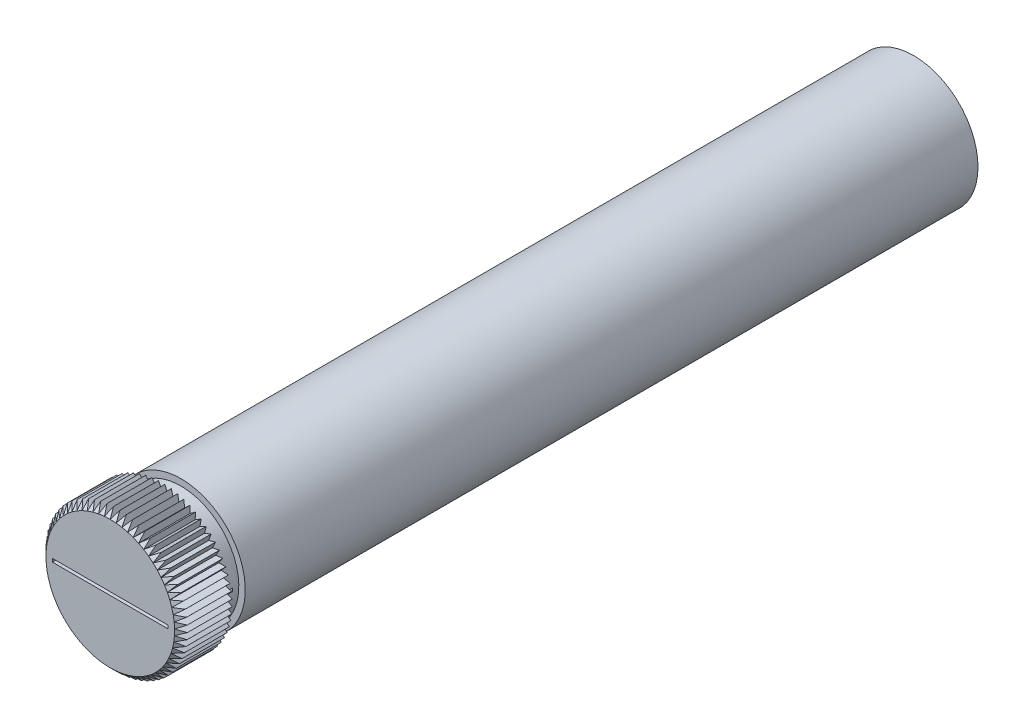
from build123d import *

# Parameters (mm, degrees)
SKETCH_1_R          = 10
EXTRUDE_1_DEPTH     = 125
SKETCH_2_R          = 11
EXTRUDE_2_DEPTH     = 8
CHAMFER_1_SIZE      = 1
CUT_EXTRUDE_1_DEPTH = 8
CUT_EXTRUDE_START   = 3
SKETCH_4_R          = 10
SKETCH_4_R_2        = 9
CUT_EXTRUDE_2_DEPTH = 3
SKETCH_5_W          = 18
SKETCH_5_H          = 0.5
CUT_EXTRUDE_3_DEPTH = 10


with BuildPart() as part:
    # 草图1 → 凸台-拉伸1 (new body)
    with BuildSketch(Plane.XY):
        Circle(SKETCH_1_R)
    extrude(amount=EXTRUDE_1_DEPTH)

    # 草图2 → 凸台-拉伸2 (add)
    with BuildSketch(Plane.XY.offset(125)):
        Circle(SKETCH_2_R)
    extrude(amount=-EXTRUDE_2_DEPTH)

    # 倒角1
    chamfer_1_edges = [part.edges().sort_by_distance(p)[0] for p in [
        (-11, 0, 125),
    ]]
    chamfer(chamfer_1_edges, length=CHAMFER_1_SIZE)

    # 草图3 → 切除-拉伸1 (cut)
    with BuildSketch(Plane.XY.offset(125)):
        Polygon((0, 11.3), (-0.5, 10.988630488), (0, 10), (0.5, 10.988630488), align=None)
        Polygon((1.497178022, 10.89763543), (0.909348623, 9.958568425), (0.501321179, 10.988570293), (1.027563944, 11.253182321), align=None)
        Polygon((2.481949955, 10.716339133), (1.811162097, 9.834617016), (1.498488253, 10.897455343), (2.04661317, 11.113117228), align=None)
        Polygon((3.446155669, 10.446243876), (2.697967712, 9.629172873), (2.483238381, 10.716040647), (3.048703514, 10.880965347), align=None)
        Polygon((4.381805452, 10.089587751), (3.562417116, 9.343938372), (3.447411614, 10.445829463), (4.025531341, 10.55865036), align=None)
        Polygon((5.281146215, 9.649326125), (4.39734721, 8.981277054), (4.383018509, 10.089060846), (4.969002347, 10.148843071), align=None)
        Polygon((6.136725737, 9.129107143), (5.1958395, 8.544194045), (5.282306332, 9.648691093), (5.871298635, 9.654939271), align=None)
        Polygon((6.941454417, 8.533241505), (5.951277428, 8.036311155), (6.137823301, 9.128369248), (6.724943494, 9.081031605), align=None)
        Polygon((7.688664019, 7.86666674), (6.657401197, 7.461836858), (6.942480333, 8.53240686), (7.522863353, 8.43187565), align=None)
        Polygon((8.37216293, 7.134906297), (7.308359643, 6.825531432), (7.689609787, 7.865742261), (8.258446396, 7.712850518), align=None)
        Polygon((8.986287463, 6.344023773), (7.898758719, 6.132667503), (8.373020712, 7.133899645), (8.925597352, 6.929914278), align=None)
        Polygon((9.525948787, 5.500572671), (8.423706193, 5.388986359), (8.987050151, 6.34294329), (9.518787998, 6.089554586), align=None)
        Polygon((9.9866751, 4.611542091), (8.878852184, 4.600650377), (9.526610062, 5.499427309), (10.033102968, 5.198734926), align=None)
        Polygon((10.364648677, 3.684298821), (9.26042521, 3.774191958), (9.987229481, 4.610341342), (10.464280487, 4.264836912), align=None)
        Polygon((10.656737512, 2.72652629), (9.565263436, 2.916459395), (10.365091572, 3.683052634), (10.808747683, 3.295599116), align=None)
        Polygon((10.860521263, 1.746160904), (9.790840877, 2.034560131), (10.65706525, 2.725244992), (11.063650191, 2.299052948), align=None)
        Polygon((10.974311314, 0.751326279), (9.935288327, 1.135801861), (10.860731128, 1.744855112), (11.226875809, 1.283456102), align=None)
        Polygon((10.997164766, -0.249734072), (9.997408848, 0.227631979), (10.974401568, 0.750006812), (11.297071999, 0.257224136), align=None)
        Polygon((10.928892247, -1.248725049), (9.976687692, -0.682424134), (10.997134661, -0.251056279), (11.273657092, -0.771139271), align=None)
        Polygon((10.770059485, -2.237368696), (9.873296559, -1.586825465), (10.928742032, -1.25003904), (11.156825112, -1.793112775), align=None)
        Polygon((10.521982619, -3.207472801), (9.688092182, -2.47807786), (10.769790405, -2.238663583), (10.947544165, -2.800227982), align=None)
        Polygon((10.18671729, -4.150998777), (9.422609221, -3.348796122), (10.521596902, -3.208737855), (10.64754842, -3.784139618), align=None)
        Polygon((9.767041614, -5.06012827), (9.079047553, -4.191765204), (10.186218135, -4.152223514), (10.259323735, -4.736694681), align=None)
        Polygon((9.266433155, -5.927327946), (8.660254038, -5), (9.766433155, -5.061302542), (9.786087063, -5.65), align=None)
        Polygon((8.689040113, -6.745411916), (8.16969893, -5.766803221), (9.265720435, -5.928442023), (9.231759791, -6.51648764), align=None)
        Polygon((8.039646948, -7.507601278), (7.611447124, -6.485820895), (8.688229037, -6.746456566), (8.60093525, -7.328977611), align=None)
        Polygon((7.323634736, -8.207580292), (6.99012447, -7.151095014), (8.038744237, -7.508567845), (7.898840651, -8.080737365), align=None)
        Polygon((6.54693658, -8.839548711), (6.310879443, -7.757112907), (7.322647871, -8.208460767), (7.131293771, -8.765537585), align=None)
        Polygon((5.715988446, -9.398269845), (5.579340482, -8.29885292), (6.545873738, -8.840335797), (6.304654745, -9.3777038), align=None)
        Polygon((4.837675832, -9.879113956), (4.801569348, -8.771826024), (5.714858434, -9.398957021), (5.425773363, -9.912163407), align=None)
        Polygon((3.919276712, -10.278096617), (3.984010898, -9.172113015), (4.836488013, -9.879695527), (4.501932315, -10.364487707), align=None)
        Polygon((2.96840123, -10.591911732), (3.13343968, -9.496396989), (3.918040929, -10.278567764), (3.540786838, -10.730928598), align=None)
        Polygon((1.992928642, -10.817958931), (2.256903793, -9.741990827), (2.967127724, -10.592268552), (2.550301286, -11.008449634), align=None)
        Polygon((1.000942019, -10.954365115), (1.361666491, -9.90685946), (1.991627965, -10.818198466), (1.538683135, -11.19475119), align=None)
        Polygon((0.000661275, -10.99999998), (0.455145991, -9.989636736), (0.999624949, -10.954485381), (0.51431497, -11.288289512), align=None)
        Polygon((-0.999624948, -10.954485381), (-0.455145991, -9.989636736), (-0.000661275, -10.99999998), (-0.51431497, -11.288289512), align=None)
        Polygon((-1.991627965, -10.818198466), (-1.361666491, -9.90685946), (-1.000942019, -10.954365115), (-1.538683135, -11.19475119), align=None)
        Polygon((-2.967127724, -10.592268552), (-2.256903793, -9.741990827), (-1.992928642, -10.817958931), (-2.550301286, -11.008449634), align=None)
        Polygon((-3.918040929, -10.278567764), (-3.13343968, -9.496396989), (-2.96840123, -10.591911732), (-3.540786838, -10.730928598), align=None)
        Polygon((-4.836488013, -9.879695527), (-3.984010898, -9.172113015), (-3.919276712, -10.278096617), (-4.501932315, -10.364487707), align=None)
        Polygon((-5.714858434, -9.398957021), (-4.801569348, -8.771826024), (-4.837675832, -9.879113956), (-5.425773363, -9.912163407), align=None)
        Polygon((-6.545873738, -8.840335797), (-5.579340482, -8.29885292), (-5.715988446, -9.398269845), (-6.304654744, -9.3777038), align=None)
        Polygon((-7.322647871, -8.208460767), (-6.310879443, -7.757112907), (-6.54693658, -8.839548711), (-7.131293771, -8.765537585), align=None)
        Polygon((-8.038744237, -7.508567845), (-6.99012447, -7.151095014), (-7.323634736, -8.207580292), (-7.898840651, -8.080737365), align=None)
        Polygon((-8.688229037, -6.746456566), (-7.611447124, -6.485820895), (-8.039646948, -7.507601278), (-8.60093525, -7.328977611), align=None)
        Polygon((-9.265720435, -5.928442023), (-8.16969893, -5.766803221), (-8.689040113, -6.745411916), (-9.231759791, -6.51648764), align=None)
        Polygon((-9.766433155, -5.061302542), (-8.660254038, -5), (-9.266433155, -5.927327946), (-9.786087063, -5.65), align=None)
        Polygon((-10.186218135, -4.152223514), (-9.079047553, -4.191765204), (-9.767041614, -5.06012827), (-10.259323735, -4.736694681), align=None)
        Polygon((-10.521596902, -3.208737855), (-9.422609221, -3.348796122), (-10.18671729, -4.150998777), (-10.64754842, -3.784139618), align=None)
        Polygon((-10.769790405, -2.238663583), (-9.688092182, -2.47807786), (-10.521982619, -3.207472801), (-10.947544165, -2.800227982), align=None)
        Polygon((-10.928742032, -1.25003904), (-9.873296559, -1.586825465), (-10.770059485, -2.237368696), (-11.156825112, -1.793112775), align=None)
        Polygon((-10.997134661, -0.251056279), (-9.976687692, -0.682424134), (-10.928892247, -1.248725049), (-11.273657092, -0.771139271), align=None)
        Polygon((-10.974401568, 0.750006812), (-9.997408848, 0.227631979), (-10.997164766, -0.249734072), (-11.297071999, 0.257224136), align=None)
        Polygon((-10.860731128, 1.744855112), (-9.935288327, 1.13580186), (-10.974311314, 0.751326279), (-11.226875809, 1.283456102), align=None)
        Polygon((-10.65706525, 2.725244992), (-9.790840877, 2.034560131), (-10.860521263, 1.746160904), (-11.063650191, 2.299052947), align=None)
        Polygon((-10.365091572, 3.683052634), (-9.565263436, 2.916459395), (-10.656737511, 2.72652629), (-10.808747683, 3.295599116), align=None)
        Polygon((-9.987229481, 4.610341342), (-9.26042521, 3.774191958), (-10.364648677, 3.684298821), (-10.464280487, 4.264836912), align=None)
        Polygon((-9.526610062, 5.499427309), (-8.878852184, 4.600650377), (-9.9866751, 4.611542091), (-10.033102968, 5.198734926), align=None)
        Polygon((-8.987050151, 6.34294329), (-8.423706193, 5.388986359), (-9.525948787, 5.500572671), (-9.518787998, 6.089554586), align=None)
        Polygon((-8.373020712, 7.133899645), (-7.898758719, 6.132667503), (-8.986287463, 6.344023773), (-8.925597352, 6.929914278), align=None)
        Polygon((-7.689609787, 7.865742261), (-7.308359643, 6.825531432), (-8.37216293, 7.134906297), (-8.258446396, 7.712850518), align=None)
        Polygon((-6.942480333, 8.53240686), (-6.657401197, 7.461836858), (-7.688664019, 7.86666674), (-7.522863353, 8.43187565), align=None)
        Polygon((-6.137823301, 9.128369248), (-5.951277428, 8.036311155), (-6.941454417, 8.533241505), (-6.724943494, 9.081031605), align=None)
        Polygon((-5.282306332, 9.648691093), (-5.1958395, 8.544194045), (-6.136725737, 9.129107143), (-5.871298635, 9.654939271), align=None)
        Polygon((-4.383018509, 10.089060846), (-4.39734721, 8.981277054), (-5.281146215, 9.649326125), (-4.969002347, 10.148843071), align=None)
        Polygon((-3.447411614, 10.445829463), (-3.562417116, 9.343938372), (-4.381805452, 10.089587751), (-4.025531341, 10.55865036), align=None)
        Polygon((-2.483238381, 10.716040647), (-2.697967712, 9.629172873), (-3.446155669, 10.446243876), (-3.048703514, 10.880965347), align=None)
        Polygon((-1.498488253, 10.897455343), (-1.811162097, 9.834617016), (-2.481949955, 10.716339133), (-2.04661317, 11.113117228), align=None)
        Polygon((-0.501321179, 10.988570293), (-0.909348623, 9.958568425), (-1.497178022, 10.89763543), (-1.027563944, 11.253182321), align=None)
    extrude(amount=-CUT_EXTRUDE_1_DEPTH, mode=Mode.SUBTRACT)

    # 草图4 → 切除-拉伸2 (cut)
    with BuildSketch(Plane(origin=(0, 0, 117), x_dir=(-1, 0, 0), z_dir=(0, 0, -1)).offset(CUT_EXTRUDE_START)):
        Circle(SKETCH_4_R)
        Circle(SKETCH_4_R_2, mode=Mode.SUBTRACT)
    extrude(amount=-CUT_EXTRUDE_2_DEPTH, mode=Mode.SUBTRACT)

    # 草图5 → 切除-拉伸3 (cut)
    with BuildSketch(Plane.XY.offset(125)):
        Rectangle(SKETCH_5_W, SKETCH_5_H)
    extrude(amount=-CUT_EXTRUDE_3_DEPTH, mode=Mode.SUBTRACT)


solid = part.part
